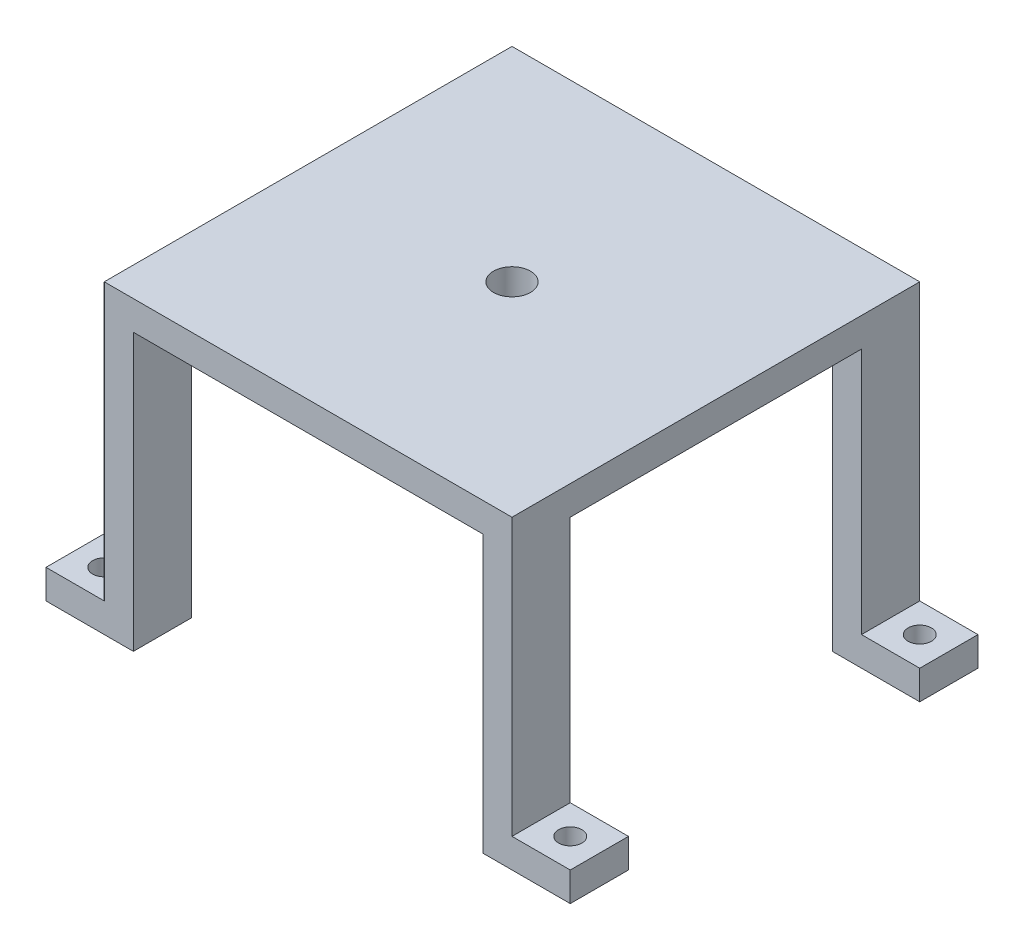
from build123d import *

# Parameters (mm, degrees)
SKETCH1_W               = 70
SKETCH1_H               = 70
BOSS_EXTRUDE1_DEPTH     = 52.45
CUT_EXTRUDE2_DEPTH      = 95.212538974
CUT_EXTRUDE2_DEPTH_BACK = 70
SKETCH2_W               = 60
SKETCH2_H               = 47.45
SKETCH3_W               = 10
SKETCH3_H               = 10
SKETCH3_R               = 2
BOSS_EXTRUDE2_DEPTH     = 5
SKETCH4_R               = 3.175
CUT_EXTRUDE3_DEPTH      = 5
SKETCH5_W               = 50
SKETCH5_H               = 47.45
CUT_EXTRUDE4_DEPTH      = 80


with BuildPart() as part:
    # Sketch1 → Boss-Extrude1 (new body)
    with BuildSketch(Plane(origin=(0, 0, 0), x_dir=(1, 0, 0), z_dir=(0, 1, 0))):
        Rectangle(SKETCH1_W, SKETCH1_H)
    extrude(amount=BOSS_EXTRUDE1_DEPTH)

    # Sketch2 → Cut-Extrude2 (cut, two sides: drawn at the far end of the back side and taken through both)
    with BuildSketch(Plane.XY.offset(35).offset(-CUT_EXTRUDE2_DEPTH_BACK)):
        with Locations((0, 23.725)):
            Rectangle(SKETCH2_W, SKETCH2_H)
    extrude(amount=CUT_EXTRUDE2_DEPTH + CUT_EXTRUDE2_DEPTH_BACK, mode=Mode.SUBTRACT)

    # Sketch3 → Boss-Extrude2 (add)
    # profile 1 of 4: a face of its own
    with BuildSketch(Plane(origin=(0, 0, 0), x_dir=(1, 0, 0), z_dir=(0, 1, 0))):
        with Locations((40, -30)):
            Rectangle(SKETCH3_W, SKETCH3_H)
        with Locations(Location((40, -30, 0), (0, 0, 270))):
            Circle(SKETCH3_R, mode=Mode.SUBTRACT)
    # profile 2 of 4: a face of its own
    with BuildSketch(Plane(origin=(0, 0, 0), x_dir=(1, 0, 0), z_dir=(0, 1, 0))):
        with Locations((40, 30)):
            Rectangle(SKETCH3_W, SKETCH3_H)
        with Locations(Location((40, 30, 0), (0, 0, 90))):
            Circle(SKETCH3_R, mode=Mode.SUBTRACT)
    # profile 3 of 4: a face of its own
    with BuildSketch(Plane(origin=(0, 0, 0), x_dir=(1, 0, 0), z_dir=(0, 1, 0))):
        with Locations((-40, -30)):
            Rectangle(SKETCH3_W, SKETCH3_H)
        with Locations(Location((-40, -30, 0), (0, 0, 90))):
            Circle(SKETCH3_R, mode=Mode.SUBTRACT)
    # profile 4 of 4: a face of its own
    with BuildSketch(Plane(origin=(0, 0, 0), x_dir=(1, 0, 0), z_dir=(0, 1, 0))):
        with Locations((-40, 30)):
            Rectangle(SKETCH3_W, SKETCH3_H)
        with Locations(Location((-40, 30, 0), (0, 0, 270))):
            Circle(SKETCH3_R, mode=Mode.SUBTRACT)
    extrude(amount=BOSS_EXTRUDE2_DEPTH)

    # Sketch4 → Cut-Extrude3 (cut)
    with BuildSketch(Plane(origin=(0, 52.45, 0), x_dir=(1, 0, 0), z_dir=(0, 1, 0))):
        with Locations(Location((0, 0, 0), (0, 0, 270))):
            Circle(SKETCH4_R)
    extrude(amount=-CUT_EXTRUDE3_DEPTH, mode=Mode.SUBTRACT)

    # Sketch5 → Cut-Extrude4 (cut)
    with BuildSketch(Plane(origin=(35, 0, 0), x_dir=(0, 0, -1), z_dir=(1, 0, 0))):
        with Locations((0, 23.725)):
            Rectangle(SKETCH5_W, SKETCH5_H)
    extrude(amount=-CUT_EXTRUDE4_DEPTH, mode=Mode.SUBTRACT)


solid = part.part
